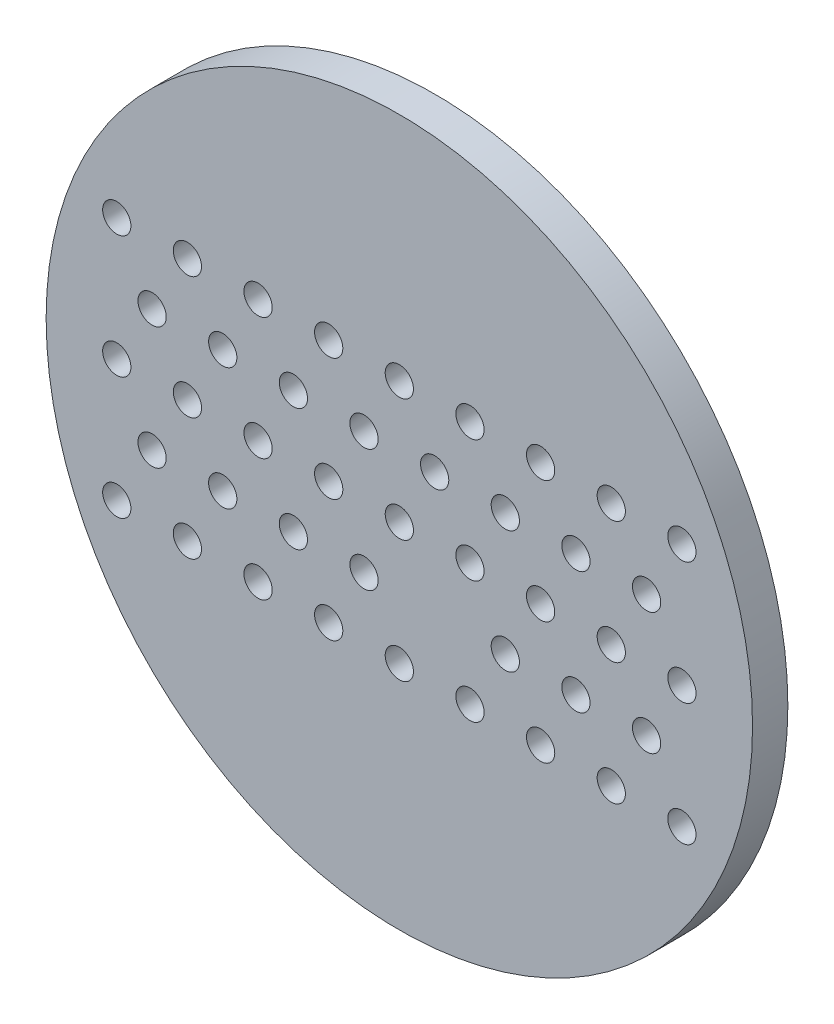
from build123d import *

# Parameters (mm, degrees)
SKETCH_1_R           = 500
EXTRUDE_1_DEPTH      = 50
SKETCH_2_R           = 20
CUT_EXTRUDE_1_DEPTH  = 709.872343938
SKETCH_3_R           = 20
CUT_EXTRUDE_2_DEPTH  = 709.872343938
SKETCH_4_R           = 20
CUT_EXTRUDE_3_DEPTH  = 709.872343938
SKETCH_5_R           = 20
CUT_EXTRUDE_4_DEPTH  = 709.872343938
SKETCH_6_R           = 20
CUT_EXTRUDE_5_DEPTH  = 709.872343938
SKETCH_7_R           = 20
CUT_EXTRUDE_6_DEPTH  = 709.872343938
SKETCH_8_R           = 20
CUT_EXTRUDE_7_DEPTH  = 709.872343938
SKETCH_9_R           = 20
CUT_EXTRUDE_8_DEPTH  = 709.872343938
SKETCH_10_R          = 20
CUT_EXTRUDE_9_DEPTH  = 709.872343938
SKETCH_11_R          = 20
CUT_EXTRUDE_10_DEPTH = 709.872343938
SKETCH_12_R          = 20
CUT_EXTRUDE_11_DEPTH = 709.872343938
SKETCH_13_R          = 20
CUT_EXTRUDE_12_DEPTH = 709.872343938
SKETCH_14_R          = 20
CUT_EXTRUDE_13_DEPTH = 709.872343938
SKETCH_15_R          = 20
CUT_EXTRUDE_14_DEPTH = 709.872343938
SKETCH_16_R          = 20
CUT_EXTRUDE_15_DEPTH = 709.872343938
SKETCH_17_R          = 20
CUT_EXTRUDE_16_DEPTH = 709.872343938
SKETCH_18_R          = 20
CUT_EXTRUDE_17_DEPTH = 709.872343938
SKETCH_19_R          = 20
CUT_EXTRUDE_18_DEPTH = 709.872343938
SKETCH_20_R          = 20
CUT_EXTRUDE_19_DEPTH = 709.872343938
SKETCH_21_R          = 20
CUT_EXTRUDE_20_DEPTH = 709.872343938
SKETCH_22_R          = 20
CUT_EXTRUDE_21_DEPTH = 709.872343938
SKETCH_23_R          = 20
CUT_EXTRUDE_22_DEPTH = 709.872343938
SKETCH_24_R          = 20
CUT_EXTRUDE_23_DEPTH = 709.872343938
SKETCH_25_R          = 20
CUT_EXTRUDE_24_DEPTH = 709.872343938
SKETCH_26_R          = 20
CUT_EXTRUDE_25_DEPTH = 709.872343938
SKETCH_27_R          = 20
CUT_EXTRUDE_26_DEPTH = 709.872343938
SKETCH_28_R          = 20
CUT_EXTRUDE_27_DEPTH = 709.872343938
SKETCH_29_R          = 20
CUT_EXTRUDE_28_DEPTH = 709.872343938
SKETCH_30_R          = 20
CUT_EXTRUDE_29_DEPTH = 709.872343938
SKETCH_31_R          = 20
CUT_EXTRUDE_30_DEPTH = 709.872343938
SKETCH_32_R          = 20
CUT_EXTRUDE_31_DEPTH = 709.872343938
SKETCH_33_R          = 20
CUT_EXTRUDE_32_DEPTH = 709.872343938
SKETCH_34_R          = 20
CUT_EXTRUDE_33_DEPTH = 709.872343938
SKETCH_35_R          = 20
CUT_EXTRUDE_34_DEPTH = 709.872343938
SKETCH_36_R          = 20
CUT_EXTRUDE_35_DEPTH = 709.872343938
SKETCH_37_R          = 20
CUT_EXTRUDE_36_DEPTH = 709.872343938
SKETCH_38_R          = 20
CUT_EXTRUDE_37_DEPTH = 709.872343938
SKETCH_39_R          = 20
CUT_EXTRUDE_38_DEPTH = 709.872343938
SKETCH_40_R          = 20
CUT_EXTRUDE_39_DEPTH = 709.872343938
SKETCH_41_R          = 20
CUT_EXTRUDE_40_DEPTH = 709.872343938
SKETCH_42_R          = 20
CUT_EXTRUDE_41_DEPTH = 709.872343938
SKETCH_43_R          = 20
CUT_EXTRUDE_42_DEPTH = 709.872343938


with BuildPart() as part:
    # 草图1 → 凸台-拉伸1 (new body)
    with BuildSketch(Plane.XY):
        Circle(SKETCH_1_R)
    extrude(amount=EXTRUDE_1_DEPTH)

    # 草图2 → 切除-拉伸1 (cut, through all)
    with BuildSketch(Plane.XY):
        with Locations((-400, 0)):
            Circle(SKETCH_2_R)
    extrude(amount=CUT_EXTRUDE_1_DEPTH, mode=Mode.SUBTRACT)

    # 草图3 → 切除-拉伸2 (cut, through all)
    with BuildSketch(Plane.XY):
        with Locations((-300, 0)):
            Circle(SKETCH_3_R)
    extrude(amount=CUT_EXTRUDE_2_DEPTH, mode=Mode.SUBTRACT)

    # 草图4 → 切除-拉伸3 (cut, through all)
    with BuildSketch(Plane.XY):
        with Locations((-200, 0)):
            Circle(SKETCH_4_R)
    extrude(amount=CUT_EXTRUDE_3_DEPTH, mode=Mode.SUBTRACT)

    # 草图5 → 切除-拉伸4 (cut, through all)
    with BuildSketch(Plane.XY):
        with Locations((-100, 0)):
            Circle(SKETCH_5_R)
    extrude(amount=CUT_EXTRUDE_4_DEPTH, mode=Mode.SUBTRACT)

    # 草图6 → 切除-拉伸5 (cut, through all)
    with BuildSketch(Plane.XY):
        Circle(SKETCH_6_R)
    extrude(amount=CUT_EXTRUDE_5_DEPTH, mode=Mode.SUBTRACT)

    # 草图7 → 切除-拉伸6 (cut, through all)
    with BuildSketch(Plane.XY):
        with Locations((100, 0)):
            Circle(SKETCH_7_R)
    extrude(amount=CUT_EXTRUDE_6_DEPTH, mode=Mode.SUBTRACT)

    # 草图8 → 切除-拉伸7 (cut, through all)
    with BuildSketch(Plane.XY):
        with Locations((200, 0)):
            Circle(SKETCH_8_R)
    extrude(amount=CUT_EXTRUDE_7_DEPTH, mode=Mode.SUBTRACT)

    # 草图9 → 切除-拉伸8 (cut, through all)
    with BuildSketch(Plane.XY):
        with Locations((300, 0)):
            Circle(SKETCH_9_R)
    extrude(amount=CUT_EXTRUDE_8_DEPTH, mode=Mode.SUBTRACT)

    # 草图10 → 切除-拉伸9 (cut, through all)
    with BuildSketch(Plane.XY):
        with Locations((400, 0)):
            Circle(SKETCH_10_R)
    extrude(amount=CUT_EXTRUDE_9_DEPTH, mode=Mode.SUBTRACT)

    # 草图11 → 切除-拉伸10 (cut, through all)
    with BuildSketch(Plane.XY):
        with Locations((-350, 86.6)):
            Circle(SKETCH_11_R)
    extrude(amount=CUT_EXTRUDE_10_DEPTH, mode=Mode.SUBTRACT)

    # 草图12 → 切除-拉伸11 (cut, through all)
    with BuildSketch(Plane.XY):
        with Locations((-250, 86.6)):
            Circle(SKETCH_12_R)
    extrude(amount=CUT_EXTRUDE_11_DEPTH, mode=Mode.SUBTRACT)

    # 草图13 → 切除-拉伸12 (cut, through all)
    with BuildSketch(Plane.XY):
        with Locations((-150, 86.6)):
            Circle(SKETCH_13_R)
    extrude(amount=CUT_EXTRUDE_12_DEPTH, mode=Mode.SUBTRACT)

    # 草图14 → 切除-拉伸13 (cut, through all)
    with BuildSketch(Plane.XY):
        with Locations((-50, 86.6)):
            Circle(SKETCH_14_R)
    extrude(amount=CUT_EXTRUDE_13_DEPTH, mode=Mode.SUBTRACT)

    # 草图15 → 切除-拉伸14 (cut, through all)
    with BuildSketch(Plane.XY):
        with Locations((50, 86.6)):
            Circle(SKETCH_15_R)
    extrude(amount=CUT_EXTRUDE_14_DEPTH, mode=Mode.SUBTRACT)

    # 草图16 → 切除-拉伸15 (cut, through all)
    with BuildSketch(Plane.XY):
        with Locations((150, 86.6)):
            Circle(SKETCH_16_R)
    extrude(amount=CUT_EXTRUDE_15_DEPTH, mode=Mode.SUBTRACT)

    # 草图17 → 切除-拉伸16 (cut, through all)
    with BuildSketch(Plane.XY):
        with Locations((250, 86.6)):
            Circle(SKETCH_17_R)
    extrude(amount=CUT_EXTRUDE_16_DEPTH, mode=Mode.SUBTRACT)

    # 草图18 → 切除-拉伸17 (cut, through all)
    with BuildSketch(Plane.XY):
        with Locations((350, 86.6)):
            Circle(SKETCH_18_R)
    extrude(amount=CUT_EXTRUDE_17_DEPTH, mode=Mode.SUBTRACT)

    # 草图19 → 切除-拉伸18 (cut, through all)
    with BuildSketch(Plane.XY):
        with Locations((-400, 173.2)):
            Circle(SKETCH_19_R)
    extrude(amount=CUT_EXTRUDE_18_DEPTH, mode=Mode.SUBTRACT)

    # 草图20 → 切除-拉伸19 (cut, through all)
    with BuildSketch(Plane.XY):
        with Locations((-300, 173.2)):
            Circle(SKETCH_20_R)
    extrude(amount=CUT_EXTRUDE_19_DEPTH, mode=Mode.SUBTRACT)

    # 草图21 → 切除-拉伸20 (cut, through all)
    with BuildSketch(Plane.XY):
        with Locations((-200, 173.2)):
            Circle(SKETCH_21_R)
    extrude(amount=CUT_EXTRUDE_20_DEPTH, mode=Mode.SUBTRACT)

    # 草图22 → 切除-拉伸21 (cut, through all)
    with BuildSketch(Plane.XY):
        with Locations((-100, 173.2)):
            Circle(SKETCH_22_R)
    extrude(amount=CUT_EXTRUDE_21_DEPTH, mode=Mode.SUBTRACT)

    # 草图23 → 切除-拉伸22 (cut, through all)
    with BuildSketch(Plane.XY):
        with Locations((0, 173.2)):
            Circle(SKETCH_23_R)
    extrude(amount=CUT_EXTRUDE_22_DEPTH, mode=Mode.SUBTRACT)

    # 草图24 → 切除-拉伸23 (cut, through all)
    with BuildSketch(Plane.XY):
        with Locations((100, 173.2)):
            Circle(SKETCH_24_R)
    extrude(amount=CUT_EXTRUDE_23_DEPTH, mode=Mode.SUBTRACT)

    # 草图25 → 切除-拉伸24 (cut, through all)
    with BuildSketch(Plane.XY):
        with Locations((200, 173.2)):
            Circle(SKETCH_25_R)
    extrude(amount=CUT_EXTRUDE_24_DEPTH, mode=Mode.SUBTRACT)

    # 草图26 → 切除-拉伸25 (cut, through all)
    with BuildSketch(Plane.XY):
        with Locations((300, 173.2)):
            Circle(SKETCH_26_R)
    extrude(amount=CUT_EXTRUDE_25_DEPTH, mode=Mode.SUBTRACT)

    # 草图27 → 切除-拉伸26 (cut, through all)
    with BuildSketch(Plane.XY):
        with Locations((400, 173.2)):
            Circle(SKETCH_27_R)
    extrude(amount=CUT_EXTRUDE_26_DEPTH, mode=Mode.SUBTRACT)

    # 草图28 → 切除-拉伸27 (cut, through all)
    with BuildSketch(Plane.XY):
        with Locations((-350, -86.6)):
            Circle(SKETCH_28_R)
    extrude(amount=CUT_EXTRUDE_27_DEPTH, mode=Mode.SUBTRACT)

    # 草图29 → 切除-拉伸28 (cut, through all)
    with BuildSketch(Plane.XY):
        with Locations((-250, -86.6)):
            Circle(SKETCH_29_R)
    extrude(amount=CUT_EXTRUDE_28_DEPTH, mode=Mode.SUBTRACT)

    # 草图30 → 切除-拉伸29 (cut, through all)
    with BuildSketch(Plane.XY):
        with Locations((-150, -86.6)):
            Circle(SKETCH_30_R)
    extrude(amount=CUT_EXTRUDE_29_DEPTH, mode=Mode.SUBTRACT)

    # 草图31 → 切除-拉伸30 (cut, through all)
    with BuildSketch(Plane.XY):
        with Locations((-50, -86.6)):
            Circle(SKETCH_31_R)
    extrude(amount=CUT_EXTRUDE_30_DEPTH, mode=Mode.SUBTRACT)

    # 草图32 → 切除-拉伸31 (cut, through all)
    with BuildSketch(Plane.XY):
        with Locations((150, -86.6)):
            Circle(SKETCH_32_R)
    extrude(amount=CUT_EXTRUDE_31_DEPTH, mode=Mode.SUBTRACT)

    # 草图33 → 切除-拉伸32 (cut, through all)
    with BuildSketch(Plane.XY):
        with Locations((250, -86.6)):
            Circle(SKETCH_33_R)
    extrude(amount=CUT_EXTRUDE_32_DEPTH, mode=Mode.SUBTRACT)

    # 草图34 → 切除-拉伸33 (cut, through all)
    with BuildSketch(Plane.XY):
        with Locations((350, -86.6)):
            Circle(SKETCH_34_R)
    extrude(amount=CUT_EXTRUDE_33_DEPTH, mode=Mode.SUBTRACT)

    # 草图35 → 切除-拉伸34 (cut, through all)
    with BuildSketch(Plane.XY):
        with Locations((-400, -173.2)):
            Circle(SKETCH_35_R)
    extrude(amount=CUT_EXTRUDE_34_DEPTH, mode=Mode.SUBTRACT)

    # 草图36 → 切除-拉伸35 (cut, through all)
    with BuildSketch(Plane.XY):
        with Locations((-300, -173.2)):
            Circle(SKETCH_36_R)
    extrude(amount=CUT_EXTRUDE_35_DEPTH, mode=Mode.SUBTRACT)

    # 草图37 → 切除-拉伸36 (cut, through all)
    with BuildSketch(Plane.XY):
        with Locations((-200, -173.2)):
            Circle(SKETCH_37_R)
    extrude(amount=CUT_EXTRUDE_36_DEPTH, mode=Mode.SUBTRACT)

    # 草图38 → 切除-拉伸37 (cut, through all)
    with BuildSketch(Plane.XY):
        with Locations((-100, -173.2)):
            Circle(SKETCH_38_R)
    extrude(amount=CUT_EXTRUDE_37_DEPTH, mode=Mode.SUBTRACT)

    # 草图39 → 切除-拉伸38 (cut, through all)
    with BuildSketch(Plane.XY):
        with Locations((0, -173.2)):
            Circle(SKETCH_39_R)
    extrude(amount=CUT_EXTRUDE_38_DEPTH, mode=Mode.SUBTRACT)

    # 草图40 → 切除-拉伸39 (cut, through all)
    with BuildSketch(Plane.XY):
        with Locations((100, -173.2)):
            Circle(SKETCH_40_R)
    extrude(amount=CUT_EXTRUDE_39_DEPTH, mode=Mode.SUBTRACT)

    # 草图41 → 切除-拉伸40 (cut, through all)
    with BuildSketch(Plane.XY):
        with Locations((200, -173.2)):
            Circle(SKETCH_41_R)
    extrude(amount=CUT_EXTRUDE_40_DEPTH, mode=Mode.SUBTRACT)

    # 草图42 → 切除-拉伸41 (cut, through all)
    with BuildSketch(Plane.XY):
        with Locations((300, -173.2)):
            Circle(SKETCH_42_R)
    extrude(amount=CUT_EXTRUDE_41_DEPTH, mode=Mode.SUBTRACT)

    # 草图43 → 切除-拉伸42 (cut, through all)
    with BuildSketch(Plane.XY):
        with Locations((400, -173.2)):
            Circle(SKETCH_43_R)
    extrude(amount=CUT_EXTRUDE_42_DEPTH, mode=Mode.SUBTRACT)


solid = part.part
